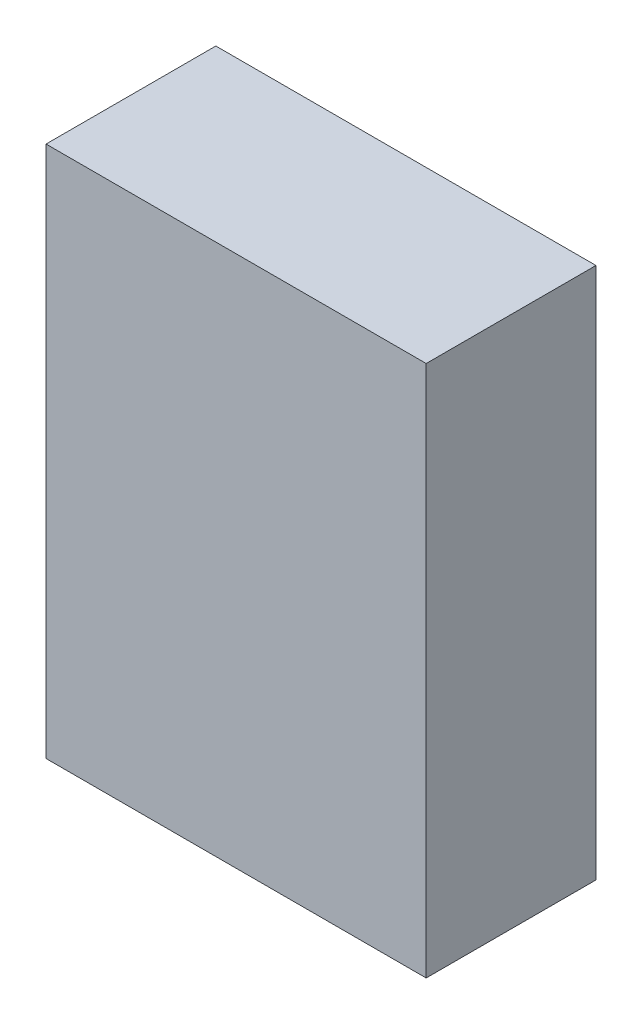
from build123d import *

# Parameters (mm, degrees)
SKETCH1_W           = 67
SKETCH1_H           = 210
BOSS_EXTRUDE1_DEPTH = 150


with BuildPart() as part:
    # Sketch1 → Boss-Extrude1 (new body)
    with BuildSketch(Plane(origin=(0, 0, 0), x_dir=(0, 0, -1), z_dir=(1, 0, 0))):
        with Locations((33.5, 105)):
            Rectangle(SKETCH1_W, SKETCH1_H)
    extrude(amount=BOSS_EXTRUDE1_DEPTH)


solid = part.part
